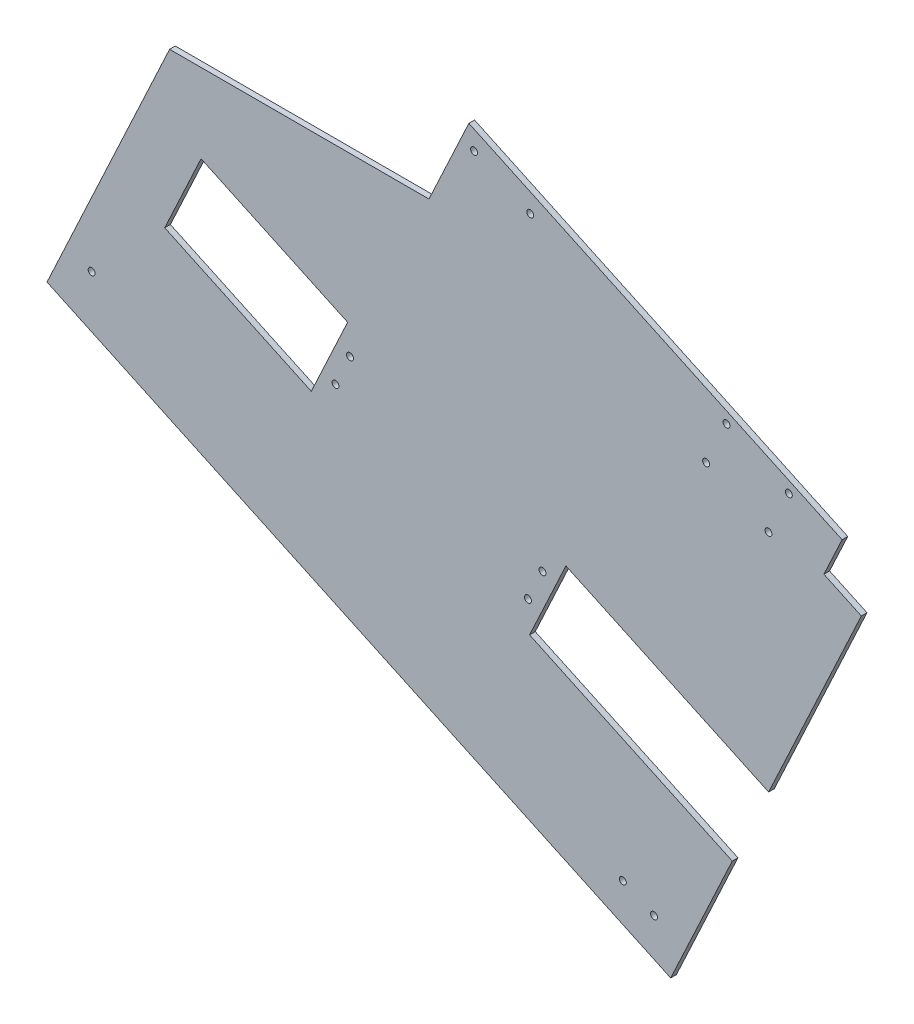
from build123d import *

# Parameters (mm, degrees)
SKETCH1_R           = 2
BOSS_EXTRUDE1_DEPTH = 3.3
SKETCH2_R           = 2
CUT_EXTRUDE1_DEPTH  = 463.683772706
CUT_EXTRUDE2_DEPTH  = 10
CUT_EXTRUDE3_DEPTH  = 10
SKETCH7_R           = 2
CUT_EXTRUDE4_DEPTH  = 10


with BuildPart() as part:
    # Sketch1 → Boss-Extrude1 (new body)
    with BuildSketch(Plane.XY):
        Polygon((-261.101380084, 0.003466677), (-110.332441909, 0.003466677), (-87.147938799, 49.722794044), (129.783117347, -51.433818728), (119.217660803, -74.091513404), (140.969047692, -84.234351686), (30.158539464, -321.868253447), (-332.364575351, -152.820948751), align=None)
        with Locations(Location((87.00354845, -69.000227384, 0), (0, 0, 180))):
            Circle(SKETCH1_R, mode=Mode.SUBTRACT)
        with Locations(Location((98.836859779, -43.623609347, 0), (0, 0, 180))):
            Circle(SKETCH1_R, mode=Mode.SUBTRACT)
        with Locations(Location((62.584548297, -26.718878877, 0), (0, 0, 180))):
            Circle(SKETCH1_R, mode=Mode.SUBTRACT)
        with Locations(Location((50.751236969, -52.095496914, 0), (0, 0, 180))):
            Circle(SKETCH1_R, mode=Mode.SUBTRACT)
        with Locations(Location((2.358593217, -286.837367237, 0), (0, 0, 180))):
            Circle(SKETCH1_R, mode=Mode.SUBTRACT)
        with Locations(Location((-306.422910118, -134.574853143, 0), (0, 0, 180))):
            Circle(SKETCH1_R, mode=Mode.SUBTRACT)
        with Locations(Location((20.484748958, -295.289732471, 0), (0, 0, 180))):
            Circle(SKETCH1_R, mode=Mode.SUBTRACT)
    extrude(amount=BOSS_EXTRUDE1_DEPTH)

    # Sketch2 → Cut-Extrude1 (cut, through all)
    with BuildSketch(Plane(origin=(0, 0, 0), x_dir=(-1, 0, 0), z_dir=(0, 0, -1))):
        with Locations((51.496578787, 22.064512657)):
            Circle(SKETCH2_R)
        with Locations((84.12365912, 37.27877008)):
            Circle(SKETCH2_R)
    extrude(amount=-CUT_EXTRUDE1_DEPTH, mode=Mode.SUBTRACT)

    # Sketch5 → Cut-Extrude2 (cut)
    with BuildSketch(Plane.XY.offset(3.3)):
        Polygon((65.954306233, -245.103983885), (-51.865706081, -190.163609859), (-30.734792994, -144.848220507), (87.08521932, -199.788594533), align=None)
    extrude(amount=-CUT_EXTRUDE2_DEPTH, mode=Mode.SUBTRACT)

    # Sketch6 → Cut-Extrude3 (cut)
    with BuildSketch(Plane.XY.offset(3.3)):
        Polygon((-178.748796266, -130.997053215), (-157.617883179, -85.681663863), (-242.810815161, -45.955547259), (-263.941728248, -91.270936611), align=None)
    extrude(amount=-CUT_EXTRUDE3_DEPTH, mode=Mode.SUBTRACT)

    # Sketch7 → Cut-Extrude4 (cut)
    with BuildSketch(Plane.XY.offset(3.3)):
        with Locations((-52.7985286, -172.571100935)):
            Circle(SKETCH7_R)
        with Locations((-44.346163365, -154.444945194)):
            Circle(SKETCH7_R)
        with Locations((-164.672545808, -120.403389962)):
            Circle(SKETCH7_R)
        with Locations((-156.220180573, -102.277234221)):
            Circle(SKETCH7_R)
    extrude(amount=-CUT_EXTRUDE4_DEPTH, mode=Mode.SUBTRACT)


solid = part.part
